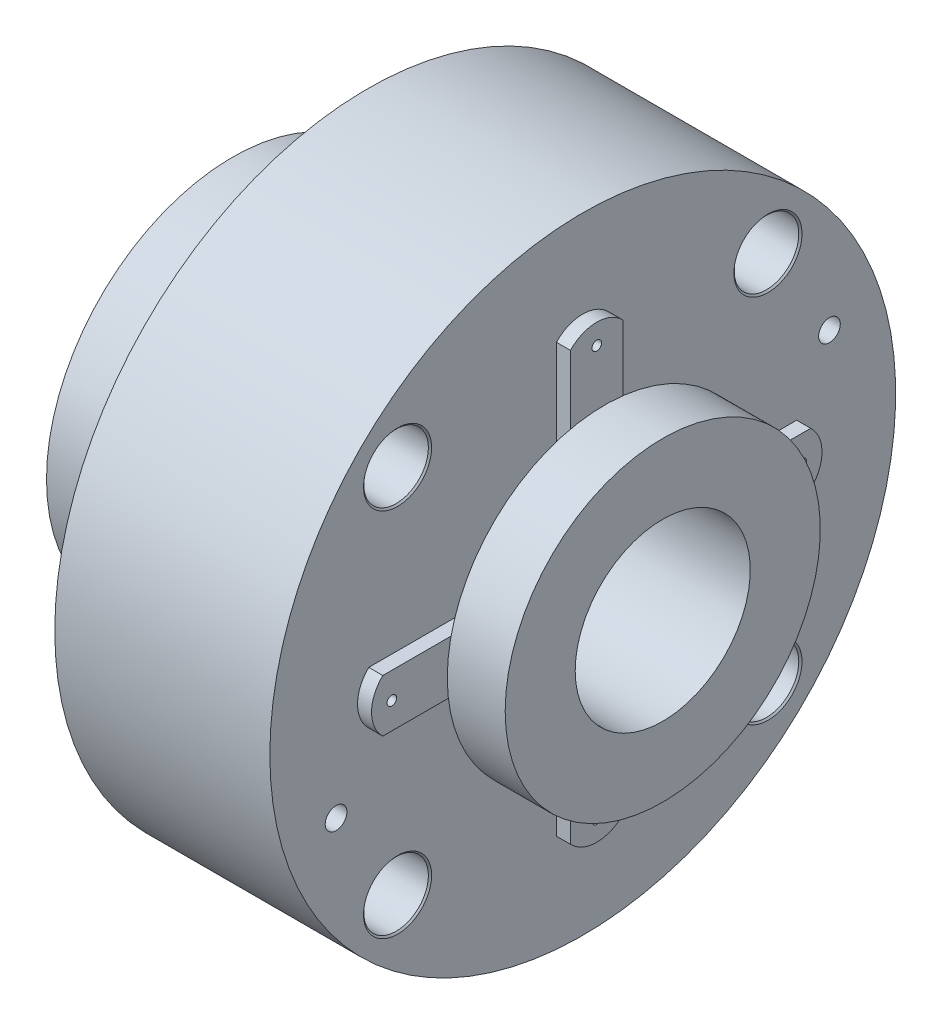
from build123d import *

# Parameters (mm, degrees)
SKETCH2_R                           = 1.725862242
BOSS_EXTRUDE1_DEPTH                 = 5.08
CIRPATTERN1_COUNT                   = 4
TAP_DRILL_FOR_1_12_TAP1_D           = 23.41626
TAP_DRILL_FOR_1_12_TAP1_CSINK_D     = 24.68626
TAP_DRILL_FOR_1_12_TAP1_CSINK_ANGLE = 100
CIRPATTERN2_COUNT                   = 4
SKETCH4_R                           = 3.927379396
CUT_EXTRUDE1_DEPTH                  = 205.678906094
CIRPATTERN3_COUNT                   = 2


with BuildPart() as part:
    # Sketch1 → Revolve1 (revolve)
    with BuildSketch(Plane.XY, mode=Mode.PRIVATE) as revolve1_sk:
        Polygon((-75.276594545, 31.75), (-75.276594545, 67.5005), (-26.279994545, 67.5005), (-26.279994545, 113.4999), (51.723405455, 113.4999), (51.723405455, 53.34), (51.723405455, 36.268932417), (59.730205455, 36.268932417), (59.730205455, 57.15), (80.730205455, 57.15), (80.730205455, 31.75), align=None)
    revolve(revolve1_sk.sketch.rotate(Axis((-77.058289091, 0, 0), (1, 0, 0)), 90), axis=Axis((-77.058289091, 0, 0), (1, 0, 0)))

    # Sketch2 → Boss-Extrude1 (add)
    with BuildSketch(Plane(origin=(51.723405455, 0, 0), x_dir=(0, 0, -1), z_dir=(1, 0, 0))):
        with BuildLine():
            Line((9.502237171, 69.200650205), (9.502237171, 77.59727245))
            ThreePointArc((9.502237171, 77.59727245), (-0.022762829, 81.693250486), (-9.547762829, 77.59727245))
            Line((-9.547762829, 77.59727245), (-9.547762829, 69.194383623))
            Line((-9.547762829, 69.194383623), (-9.547762829, 40.334566498))
            Line((-9.547762829, 40.334566498), (9.502237171, 40.334566498))
            Line((9.502237171, 40.334566498), (9.502237171, 69.200650205))
        make_face()
        with Locations((0, 74.333669045)):
            Circle(SKETCH2_R, mode=Mode.SUBTRACT)
    boss_extrude1 = extrude(amount=BOSS_EXTRUDE1_DEPTH)

    # CirPattern1: Boss-Extrude1 ×4 about axis
    cirpattern1_axis = Axis((0, 0, 0), (1, 0, 0))
    for i in range(1, CIRPATTERN1_COUNT):
        add(boss_extrude1.rotate(cirpattern1_axis, i * 360 / CIRPATTERN1_COUNT))

    # Tap Drill for 1-12 Tap1 (through all)
    with Locations(Plane(origin=(51.723405455, 67.172315786, 67.172315786), x_dir=(0, 0, 1), z_dir=(1, 0, 0))):
        with Locations((0, 0)):
            tap_drill_for_1_12_tap1 = CounterSinkHole(TAP_DRILL_FOR_1_12_TAP1_D / 2, TAP_DRILL_FOR_1_12_TAP1_CSINK_D / 2, counter_sink_angle=TAP_DRILL_FOR_1_12_TAP1_CSINK_ANGLE)

    # CirPattern2: Tap Drill for 1-12 Tap1 ×4 about axis
    cirpattern2_axis = Axis((0, 0, 0), (1, 0, 0))
    for i in range(1, CIRPATTERN2_COUNT):
        add(tap_drill_for_1_12_tap1.rotate(cirpattern2_axis, i * 360 / CIRPATTERN2_COUNT), mode=Mode.SUBTRACT)

    # Sketch4 → Cut-Extrude1 (cut, through all)
    with BuildSketch(Plane(origin=(51.723405455, 0, 0), x_dir=(0, 0, -1), z_dir=(1, 0, 0))):
        with Locations((-89.48120145, -31.895996663)):
            Circle(SKETCH4_R)
    cut_extrude1 = extrude(amount=-CUT_EXTRUDE1_DEPTH, mode=Mode.SUBTRACT)

    # CirPattern3: Cut-Extrude1 ×2 about axis
    cirpattern3_axis = Axis((0, 0, 0), (1, 0, 0))
    for i in range(1, CIRPATTERN3_COUNT):
        add(cut_extrude1.rotate(cirpattern3_axis, i * 360 / CIRPATTERN3_COUNT), mode=Mode.SUBTRACT)


solid = part.part
